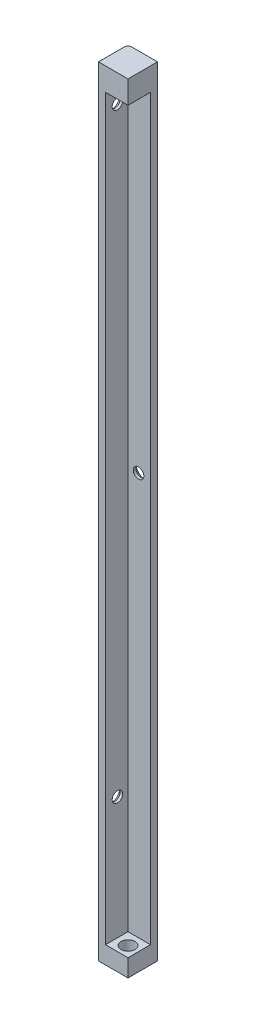
from build123d import *

# Parameters (mm, degrees)
BOSS_EXTRUDE1_DEPTH                                 = 221.5
CSK_FOR_M3_COUNTERSUNK_FLAT_HEAD_SCREW1_D           = 3
CSK_FOR_M3_COUNTERSUNK_FLAT_HEAD_SCREW1_CSINK_D     = 5.5
CSK_FOR_M3_COUNTERSUNK_FLAT_HEAD_SCREW1_CSINK_ANGLE = 90
CSK_FOR_M3_COUNTERSUNK_FLAT_HEAD_SCREW4_D           = 3
CSK_FOR_M3_COUNTERSUNK_FLAT_HEAD_SCREW4_CSINK_D     = 5.5
CSK_FOR_M3_COUNTERSUNK_FLAT_HEAD_SCREW4_CSINK_ANGLE = 90
SKETCH12_W                                          = 8
SKETCH12_H                                          = 7
BOSS_EXTRUDE2_DEPTH                                 = 5.5
CUT_EXTRUDE1_DEPTH                                  = 359
BOSS_EXTRUDE3_DEPTH                                 = 3
BOSS_EXTRUDE4_DEPTH                                 = 2.5
BOSS_EXTRUDE4_DEPTH_BACK                            = 6
SKETCH19_W                                          = 9
SKETCH19_H                                          = 2
CUT_EXTRUDE2_DEPTH                                  = 10
SKETCH20_W                                          = 0.6
SKETCH20_H                                          = 225
CUT_EXTRUDE3_DEPTH                                  = 10
SKETCH22_W                                          = 0.6
SKETCH22_H                                          = 225
CUT_EXTRUDE4_DEPTH                                  = 10
SKETCH25_W                                          = 8.4
SKETCH25_H                                          = 5.5
CUT_EXTRUDE5_DEPTH                                  = 10
BOSS_EXTRUDE5_DEPTH                                 = 2
TAP_DRILL_FOR_M4X0_7_TAP1_D                         = 4
TAP_DRILL_FOR_M4X0_7_TAP1_DEPTH                     = 5
BOSS_EXTRUDE6_DEPTH                                 = 221.5
FILLET1_R                                           = 1


with BuildPart() as part:
    # Sketch1 → Boss-Extrude1 (new body)
    with BuildSketch(Plane(origin=(0, 0, 0), x_dir=(1, 0, 0), z_dir=(0, 1, 0))):
        Polygon((0, 0), (0, 9), (9, 9), (9, 7), (2, 7), (2, 0), align=None)
    extrude(amount=BOSS_EXTRUDE1_DEPTH)

    # CSK for M3 Countersunk Flat Head Screw1 (through all)
    with Locations(Plane.ZY):
        with Locations((-4, 211), (-4, 40.25)):
            CounterSinkHole(CSK_FOR_M3_COUNTERSUNK_FLAT_HEAD_SCREW1_D / 2, CSK_FOR_M3_COUNTERSUNK_FLAT_HEAD_SCREW1_CSINK_D / 2, counter_sink_angle=CSK_FOR_M3_COUNTERSUNK_FLAT_HEAD_SCREW1_CSINK_ANGLE)

    # CSK for M3 Countersunk Flat Head Screw4 (through all)
    with Locations(Plane(origin=(0, 0, -9), x_dir=(-1, 0, 0), z_dir=(0, 0, -1))):
        with Locations((-5, 120)):
            CounterSinkHole(CSK_FOR_M3_COUNTERSUNK_FLAT_HEAD_SCREW4_D / 2, CSK_FOR_M3_COUNTERSUNK_FLAT_HEAD_SCREW4_CSINK_D / 2, counter_sink_angle=CSK_FOR_M3_COUNTERSUNK_FLAT_HEAD_SCREW4_CSINK_ANGLE)

    # Sketch12 → Boss-Extrude2 (add)
    with BuildSketch(Plane.XZ):
        with Locations((5, -3.5)):
            Rectangle(SKETCH12_W, SKETCH12_H)
    extrude(amount=-BOSS_EXTRUDE2_DEPTH)

    # Sketch13 → Cut-Extrude1 (cut)
    with BuildSketch(Plane(origin=(0, 221.5, 0), x_dir=(1, 0, 0), z_dir=(0, 1, 0))):
        Polygon((0, 8), (1, 9), (0, 9), align=None)
    extrude(amount=-CUT_EXTRUDE1_DEPTH, mode=Mode.SUBTRACT)

    # Sketch14 → Boss-Extrude3 (add)
    with BuildSketch(Plane.XZ):
        Polygon((0, 0), (9, 0), (9, -9), (1, -9), (0, -8), align=None)
    extrude(amount=BOSS_EXTRUDE3_DEPTH)

    # Sketch18 → Boss-Extrude4 (add, two sides: drawn at the far end of the back side and taken through both)
    with BuildSketch(Plane(origin=(0, 221.5, 0), x_dir=(1, 0, 0), z_dir=(0, 1, 0)).offset(-BOSS_EXTRUDE4_DEPTH_BACK)):
        Polygon((0, 0), (9, 0), (9, 9), (1, 9), (0, 8), align=None)
    extrude(amount=BOSS_EXTRUDE4_DEPTH + BOSS_EXTRUDE4_DEPTH_BACK)

    # Sketch19 → Cut-Extrude2 (cut)
    with BuildSketch(Plane(origin=(0, 0, -9), x_dir=(-1, 0, 0), z_dir=(0, 0, -1))):
        with Locations((-4.5, 223)):
            Rectangle(SKETCH19_W, SKETCH19_H)
    extrude(amount=-CUT_EXTRUDE2_DEPTH, mode=Mode.SUBTRACT)

    # Sketch20 → Cut-Extrude3 (cut)
    with BuildSketch(Plane.ZY):
        with Locations((-0.3, 109.5)):
            Rectangle(SKETCH20_W, SKETCH20_H)
    extrude(amount=-CUT_EXTRUDE3_DEPTH, mode=Mode.SUBTRACT)

    # Sketch22 → Cut-Extrude4 (cut)
    with BuildSketch(Plane(origin=(0, 0, -9), x_dir=(-1, 0, 0), z_dir=(0, 0, -1))):
        with Locations((-8.7, 109.5)):
            Rectangle(SKETCH22_W, SKETCH22_H)
    extrude(amount=-CUT_EXTRUDE4_DEPTH, mode=Mode.SUBTRACT)

    # Sketch25 → Cut-Extrude5 (cut)
    with BuildSketch(Plane.ZY):
        with Locations((-4.8, -0.25)):
            Rectangle(SKETCH25_W, SKETCH25_H)
    extrude(amount=-CUT_EXTRUDE5_DEPTH, mode=Mode.SUBTRACT)

    # Sketch29 → Boss-Extrude5 (add)
    with BuildSketch(Plane.XZ.offset(-2.5)):
        Polygon((8.4, -0.6), (0, -0.6), (0, -8), (1, -9), (8.4, -9), align=None)
    extrude(amount=BOSS_EXTRUDE5_DEPTH)

    # Tap Drill for M4x0.7 Tap1
    with Locations(Plane(origin=(0, 0.5, 0), x_dir=(-1, 0, 0), z_dir=(0, -1, 0))):
        with Locations((-5.4, 3.6)):
            Hole(TAP_DRILL_FOR_M4X0_7_TAP1_D / 2, depth=TAP_DRILL_FOR_M4X0_7_TAP1_DEPTH)

    # Sketch32 → Boss-Extrude6 (add)
    with BuildSketch(Plane(origin=(0, 222, 0), x_dir=(1, 0, 0), z_dir=(0, 1, 0))):
        Polygon((1, 9), (0, 8), (0, 9), align=None)
    extrude(amount=-BOSS_EXTRUDE6_DEPTH)

    # Fillet1
    fillet1_edges = [part.edges().sort_by_distance(p)[0] for p in [
        (0, 111.25, -9),
    ]]
    fillet(fillet1_edges, radius=FILLET1_R)


solid = part.part
